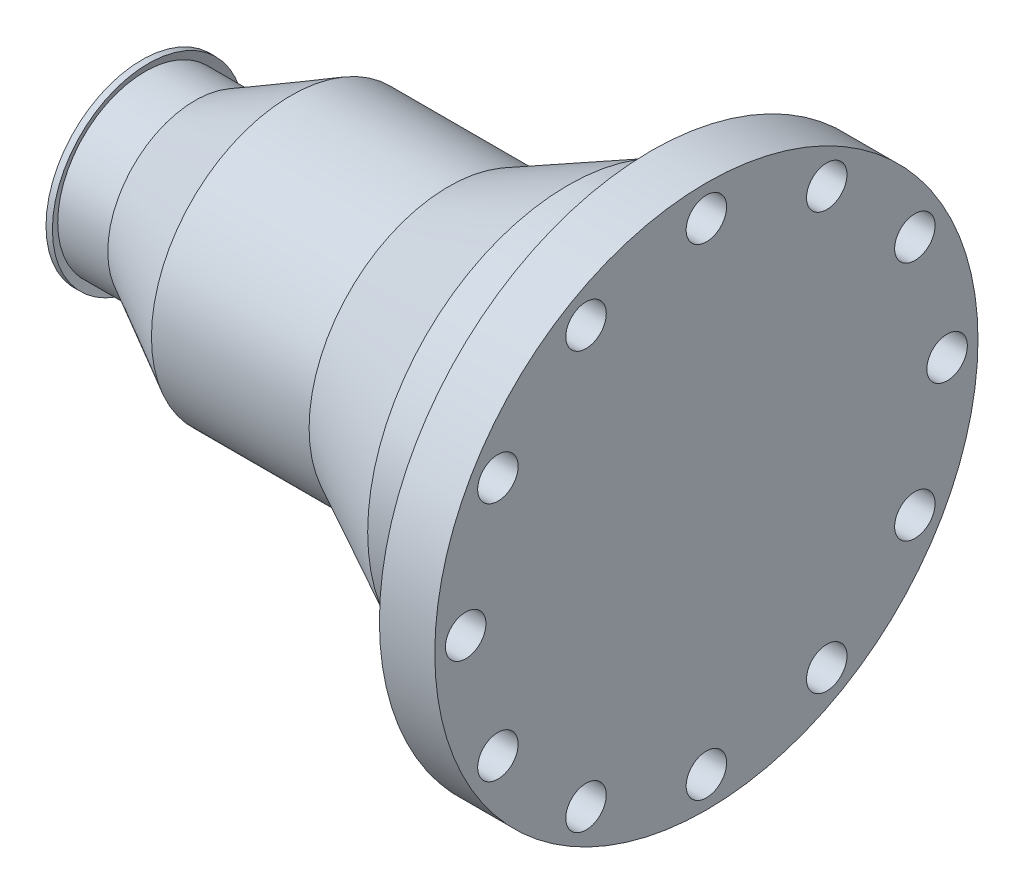
from build123d import *

# Parameters (mm, degrees)
SKETCH_2_W           = 38
SKETCH_2_H           = 31
SKETCH_3_R           = 9.5
CUT_EXTRUDE_1_DEPTH  = 321.526909947
SKETCH_4_R           = 9.5
CUT_EXTRUDE_2_DEPTH  = 321.526909947
SKETCH_5_R           = 9.5
CUT_EXTRUDE_3_DEPTH  = 321.526909947
SKETCH_6_R           = 9.5
CUT_EXTRUDE_4_DEPTH  = 321.526909947
SKETCH_7_R           = 9.5
CUT_EXTRUDE_5_DEPTH  = 321.526909947
SKETCH_8_R           = 9.5
CUT_EXTRUDE_6_DEPTH  = 321.526909947
SKETCH_9_R           = 9.5
CUT_EXTRUDE_7_DEPTH  = 321.526909947
SKETCH_10_R          = 9.5
CUT_EXTRUDE_8_DEPTH  = 321.526909947
SKETCH_11_R          = 9.5
CUT_EXTRUDE_9_DEPTH  = 321.526909947
SKETCH_12_R          = 9.5
CUT_EXTRUDE_10_DEPTH = 321.526909947
SKETCH_13_R          = 9.5
CUT_EXTRUDE_11_DEPTH = 321.526909947
SKETCH_14_R          = 9.5
CUT_EXTRUDE_12_DEPTH = 321.526909947


with BuildPart() as part:
    # Эскиз1 → Повернуть1 (revolve)
    with BuildSketch(Plane.XY, mode=Mode.PRIVATE) as revolve_1_sk:
        Polygon((0, 0), (265, 0), (265, 127.5), (239, 127.5), (239, 100), (239, 95), (220, 95), (220, 94), (200, 94), (144, 65.5), (70, 65.5), (25, 41), (1.5, 41), (3, 45), (0, 45), align=None)
    revolve(revolve_1_sk.sketch.rotate(Axis((0, 0, 0), (1, 0, 0)), 90), axis=Axis((0, 0, 0), (1, 0, 0)))

    # Эскиз2 → Вырез-Повернуть1 (revolve, cut)
    with BuildSketch(Plane.XY, mode=Mode.PRIVATE) as cut_revolve_1_sk:
        with Locations((19, 15.5)):
            Rectangle(SKETCH_2_W, SKETCH_2_H)
    revolve(cut_revolve_1_sk.sketch.rotate(Axis((0, 0, 0), (1, 0, 0)), 90), axis=Axis((0, 0, 0), (1, 0, 0)), mode=Mode.SUBTRACT)

    # Эскиз3 → Вырез-Вытянуть1 (cut, through all)
    with BuildSketch(Plane(origin=(0, 0, 0), x_dir=(0, 0, -1), z_dir=(1, 0, 0))):
        with Locations((0, 113)):
            Circle(SKETCH_3_R)
    extrude(amount=CUT_EXTRUDE_1_DEPTH, mode=Mode.SUBTRACT)

    # Эскиз4 → Вырез-Вытянуть2 (cut, through all)
    with BuildSketch(Plane(origin=(0, 0, 0), x_dir=(0, 0, -1), z_dir=(1, 0, 0))):
        with Locations((-56.5, 97.860870628)):
            Circle(SKETCH_4_R)
    extrude(amount=CUT_EXTRUDE_2_DEPTH, mode=Mode.SUBTRACT)

    # Эскиз5 → Вырез-Вытянуть3 (cut, through all)
    with BuildSketch(Plane(origin=(0, 0, 0), x_dir=(0, 0, -1), z_dir=(1, 0, 0))):
        with Locations((-97.860870628, 56.5)):
            Circle(SKETCH_5_R)
    extrude(amount=CUT_EXTRUDE_3_DEPTH, mode=Mode.SUBTRACT)

    # Эскиз6 → Вырез-Вытянуть4 (cut, through all)
    with BuildSketch(Plane(origin=(0, 0, 0), x_dir=(0, 0, -1), z_dir=(1, 0, 0))):
        with Locations((-113, 0)):
            Circle(SKETCH_6_R)
    extrude(amount=CUT_EXTRUDE_4_DEPTH, mode=Mode.SUBTRACT)

    # Эскиз7 → Вырез-Вытянуть5 (cut, through all)
    with BuildSketch(Plane(origin=(0, 0, 0), x_dir=(0, 0, -1), z_dir=(1, 0, 0))):
        with Locations((-97.860870628, -56.5)):
            Circle(SKETCH_7_R)
    extrude(amount=CUT_EXTRUDE_5_DEPTH, mode=Mode.SUBTRACT)

    # Эскиз8 → Вырез-Вытянуть6 (cut, through all)
    with BuildSketch(Plane(origin=(0, 0, 0), x_dir=(0, 0, -1), z_dir=(1, 0, 0))):
        with Locations((-56.5, -97.860870628)):
            Circle(SKETCH_8_R)
    extrude(amount=CUT_EXTRUDE_6_DEPTH, mode=Mode.SUBTRACT)

    # Эскиз9 → Вырез-Вытянуть7 (cut, through all)
    with BuildSketch(Plane(origin=(0, 0, 0), x_dir=(0, 0, -1), z_dir=(1, 0, 0))):
        with Locations((0, -113)):
            Circle(SKETCH_9_R)
    extrude(amount=CUT_EXTRUDE_7_DEPTH, mode=Mode.SUBTRACT)

    # Эскиз10 → Вырез-Вытянуть8 (cut, through all)
    with BuildSketch(Plane(origin=(0, 0, 0), x_dir=(0, 0, -1), z_dir=(1, 0, 0))):
        with Locations((56.5, -97.860870628)):
            Circle(SKETCH_10_R)
    extrude(amount=CUT_EXTRUDE_8_DEPTH, mode=Mode.SUBTRACT)

    # Эскиз11 → Вырез-Вытянуть9 (cut, through all)
    with BuildSketch(Plane(origin=(0, 0, 0), x_dir=(0, 0, -1), z_dir=(1, 0, 0))):
        with Locations((97.860870628, -56.5)):
            Circle(SKETCH_11_R)
    extrude(amount=CUT_EXTRUDE_9_DEPTH, mode=Mode.SUBTRACT)

    # Эскиз12 → Вырез-Вытянуть10 (cut, through all)
    with BuildSketch(Plane(origin=(0, 0, 0), x_dir=(0, 0, -1), z_dir=(1, 0, 0))):
        with Locations((113, 0)):
            Circle(SKETCH_12_R)
    extrude(amount=CUT_EXTRUDE_10_DEPTH, mode=Mode.SUBTRACT)

    # Эскиз13 → Вырез-Вытянуть11 (cut, through all)
    with BuildSketch(Plane(origin=(0, 0, 0), x_dir=(0, 0, -1), z_dir=(1, 0, 0))):
        with Locations((97.860870628, 56.5)):
            Circle(SKETCH_13_R)
    extrude(amount=CUT_EXTRUDE_11_DEPTH, mode=Mode.SUBTRACT)

    # Эскиз14 → Вырез-Вытянуть12 (cut, through all)
    with BuildSketch(Plane(origin=(0, 0, 0), x_dir=(0, 0, -1), z_dir=(1, 0, 0))):
        with Locations((56.5, 97.860870628)):
            Circle(SKETCH_14_R)
    extrude(amount=CUT_EXTRUDE_12_DEPTH, mode=Mode.SUBTRACT)


solid = part.part
